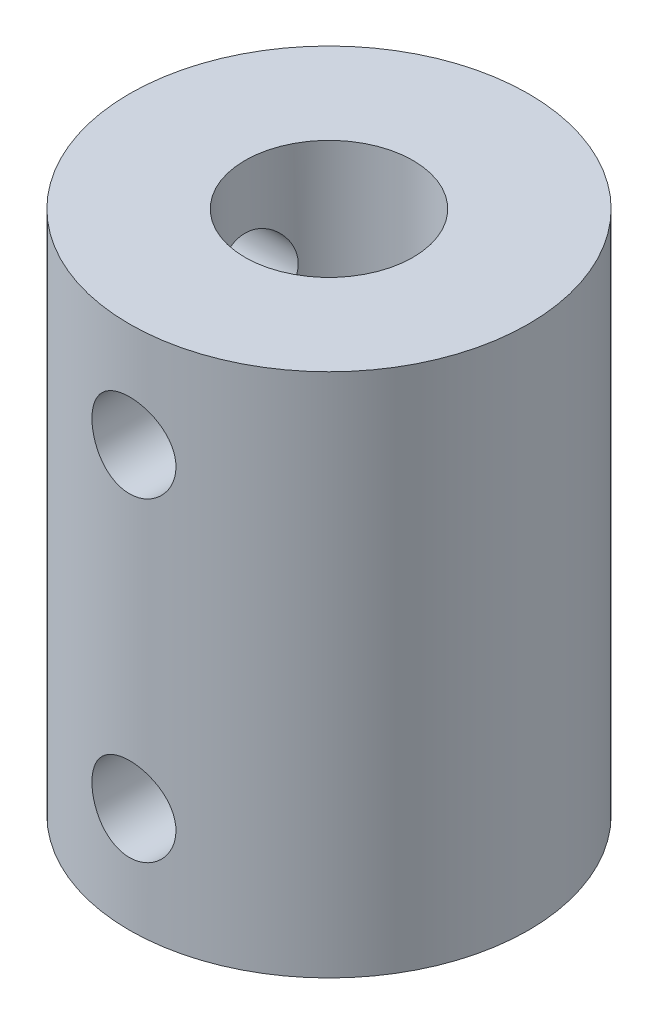
from build123d import *

# Parameters (mm, degrees)
SKETCH1_R           = 9.5
BOSS_EXTRUDE1_DEPTH = 25
SKETCH2_R           = 4
CUT_EXTRUDE1_DEPTH  = 25
SKETCH3_R           = 2
CUT_EXTRUDE2_DEPTH  = 10
SKETCH4_R           = 2
CUT_EXTRUDE3_DEPTH  = 10


with BuildPart() as part:
    # Sketch1 → Boss-Extrude1 (new body)
    with BuildSketch(Plane(origin=(0, 0, 0), x_dir=(1, 0, 0), z_dir=(0, 1, 0))):
        with Locations(Location((0, 0, 0), (0, 0, 270))):
            Circle(SKETCH1_R)
    extrude(amount=BOSS_EXTRUDE1_DEPTH)

    # Sketch2 → Cut-Extrude1 (cut)
    with BuildSketch(Plane(origin=(0, 25, 0), x_dir=(1, 0, 0), z_dir=(0, 1, 0))):
        with Locations(Location((0, 0, 0), (0, 0, 270))):
            Circle(SKETCH2_R)
    extrude(amount=-CUT_EXTRUDE1_DEPTH, mode=Mode.SUBTRACT)

    # Sketch3 → Cut-Extrude2 (cut)
    with BuildSketch(Plane.XY):
        with Locations(Location((0, 20, 0), (0, 0, 270))):
            Circle(SKETCH3_R)
        with Locations(Location((0, 5, 0), (0, 0, 270))):
            Circle(SKETCH3_R)
    extrude(amount=CUT_EXTRUDE2_DEPTH, mode=Mode.SUBTRACT)

    # Sketch4 → Cut-Extrude3 (cut)
    with BuildSketch(Plane(origin=(0, 0, 0), x_dir=(0, 0, -1), z_dir=(1, 0, 0))):
        with Locations((0, 20)):
            Circle(SKETCH4_R)
        with Locations((0, 5)):
            Circle(SKETCH4_R)
    extrude(amount=-CUT_EXTRUDE3_DEPTH, mode=Mode.SUBTRACT)


solid = part.part
